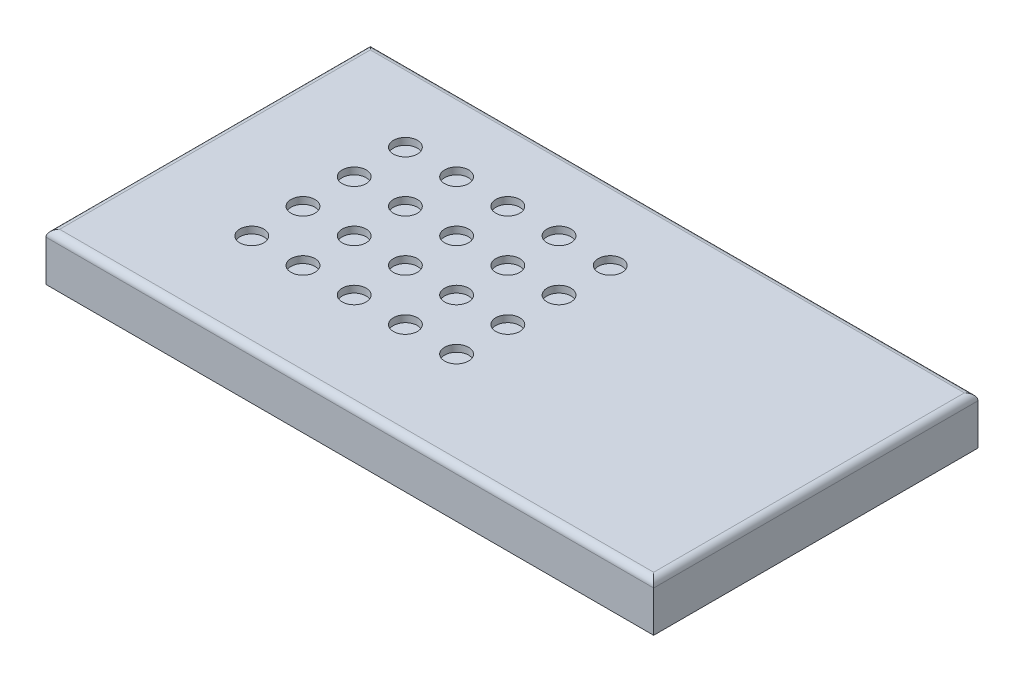
from build123d import *

# Parameters (mm, degrees)
ESQUISSE1_W                     = 35.6
ESQUISSE1_H                     = 19
BOSS_EXTRU_1_DEPTH              = 2.8
CONG_1_R                        = 0.4
ESQUISSE2_R                     = 0.701862225
ENL_V_MAT_EXTRU_1_DEPTH         = 0.4
R_P_TITION_LIN_AIRE1_COUNT      = 5
R_P_TITION_LIN_AIRE1_PITCH      = 3
R_P_TITION_LIN_AIRE1_COUNT_DIR2 = 4
R_P_TITION_LIN_AIRE1_PITCH_DIR2 = 3


with BuildPart() as part:
    # Esquisse1 → Boss.-Extru.1 (new body)
    with BuildSketch(Plane(origin=(0, 0, 0), x_dir=(1, 0, 0), z_dir=(0, 1, 0))):
        with Locations((17.8, 9.5)):
            Rectangle(ESQUISSE1_W, ESQUISSE1_H)
    extrude(amount=BOSS_EXTRU_1_DEPTH)

    # Congé1
    cong_1_edges = [part.edges().sort_by_distance(p)[0] for p in [
        (35.6, 2.8, -9.5),
        (17.8, 2.8, -19),
        (0, 2.8, -9.5),
        (17.8, 2.8, 0),
    ]]
    fillet(cong_1_edges, radius=CONG_1_R)

    # Esquisse2 → Enlèv. mat.-Extru.1 (cut)
    with BuildSketch(Plane(origin=(0, 2.8, 0), x_dir=(1, 0, 0), z_dir=(0, 1, 0))):
        with Locations(Location((6.361489544, 14.69324156, 0), (0, 0, 270))):
            Circle(ESQUISSE2_R)
    enl_v_mat_extru_1 = extrude(amount=-ENL_V_MAT_EXTRU_1_DEPTH, mode=Mode.SUBTRACT)

    # Répétition linéaire1: Enl_v. mat.-Extru.1 5 × 4
    with Locations(*[(i * R_P_TITION_LIN_AIRE1_PITCH, 0, j * R_P_TITION_LIN_AIRE1_PITCH_DIR2) for i in range(R_P_TITION_LIN_AIRE1_COUNT) for j in range(R_P_TITION_LIN_AIRE1_COUNT_DIR2) if (i, j) != (0, 0)]):
        add(enl_v_mat_extru_1, mode=Mode.SUBTRACT)


solid = part.part
